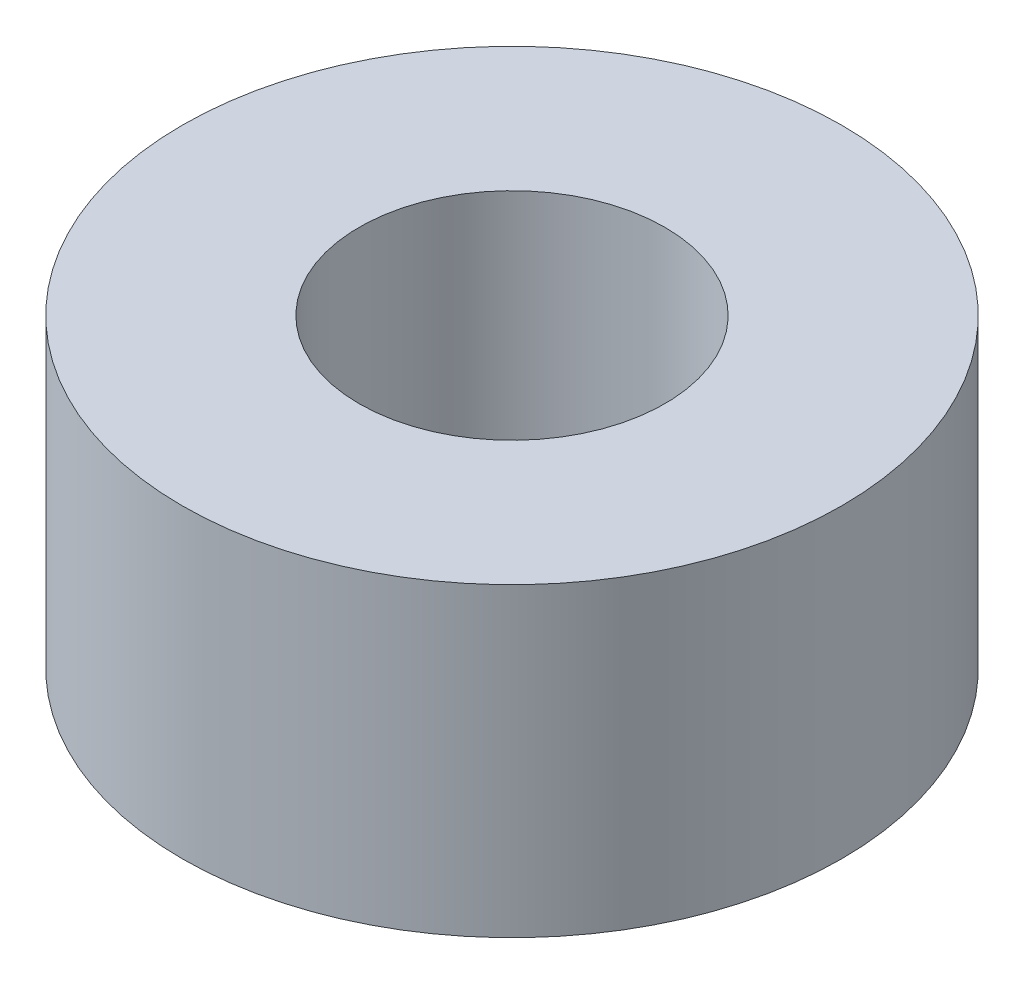
from build123d import *

# Parameters (mm, degrees)
SKETCH1_R           = 5.5
SKETCH1_R_2         = 2.55
BOSS_EXTRUDE1_DEPTH = 5.1


with BuildPart() as part:
    # Sketch1 → Boss-Extrude1 (new body)
    with BuildSketch(Plane(origin=(0, 0, 0), x_dir=(1, 0, 0), z_dir=(0, 1, 0))):
        with Locations(Location((0, 0, 0), (0, 0, 270))):
            Circle(SKETCH1_R)
        with Locations(Location((0, 0, 0), (0, 0, 270))):
            Circle(SKETCH1_R_2, mode=Mode.SUBTRACT)
    extrude(amount=BOSS_EXTRUDE1_DEPTH)


solid = part.part
